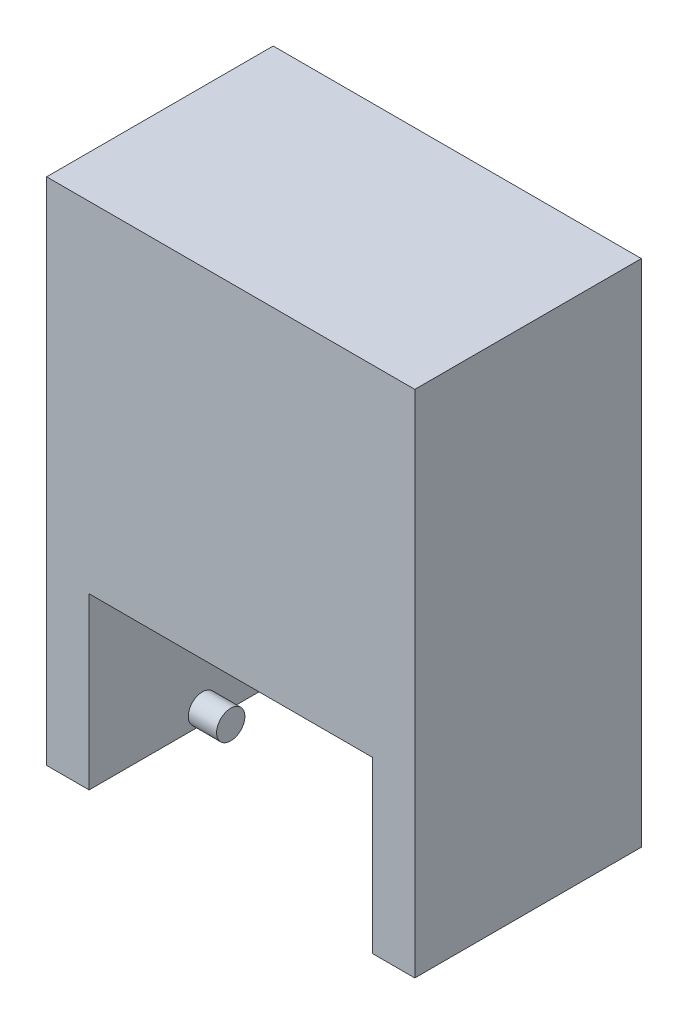
from build123d import *

# Parameters (mm, degrees)
SKETCH1_W               = 330.2
SKETCH1_H               = 457.2
BOSS_EXTRUDE1_DEPTH     = 203.2
CUT_EXTRUDE1_DEPTH      = 115.316
CUT_EXTRUDE1_DEPTH_BACK = 294.386
SKETCH2_W               = 254
SKETCH2_H               = 152.4
SKETCH3_R               = 12.7
BOSS_EXTRUDE2_DEPTH     = 25.4


with BuildPart() as part:
    # Sketch1 → Boss-Extrude1 (new body)
    with BuildSketch(Plane.XY):
        with Locations((165.1, 228.6)):
            Rectangle(SKETCH1_W, SKETCH1_H)
    extrude(amount=BOSS_EXTRUDE1_DEPTH)

    # Sketch2 → Cut-Extrude1 (cut, two sides: drawn at the far end of the back side and taken through both)
    with BuildSketch(Plane.XY.offset(203.2).offset(-CUT_EXTRUDE1_DEPTH_BACK)):
        with Locations((165.1, 76.2)):
            Rectangle(SKETCH2_W, SKETCH2_H)
    extrude(amount=CUT_EXTRUDE1_DEPTH + CUT_EXTRUDE1_DEPTH_BACK, mode=Mode.SUBTRACT)

    # Sketch3 → Boss-Extrude2 (add)
    with BuildSketch(Plane.ZY.offset(-292.1)):
        with Locations(Location((101.6, 12.7, 0), (0, 0, 270))):
            Circle(SKETCH3_R)
    boss_extrude2 = extrude(amount=BOSS_EXTRUDE2_DEPTH)

    # Mirror1: Boss-Extrude2 across plane
    add(boss_extrude2.mirror(Plane.ZY.offset(-165.1)))


solid = part.part
